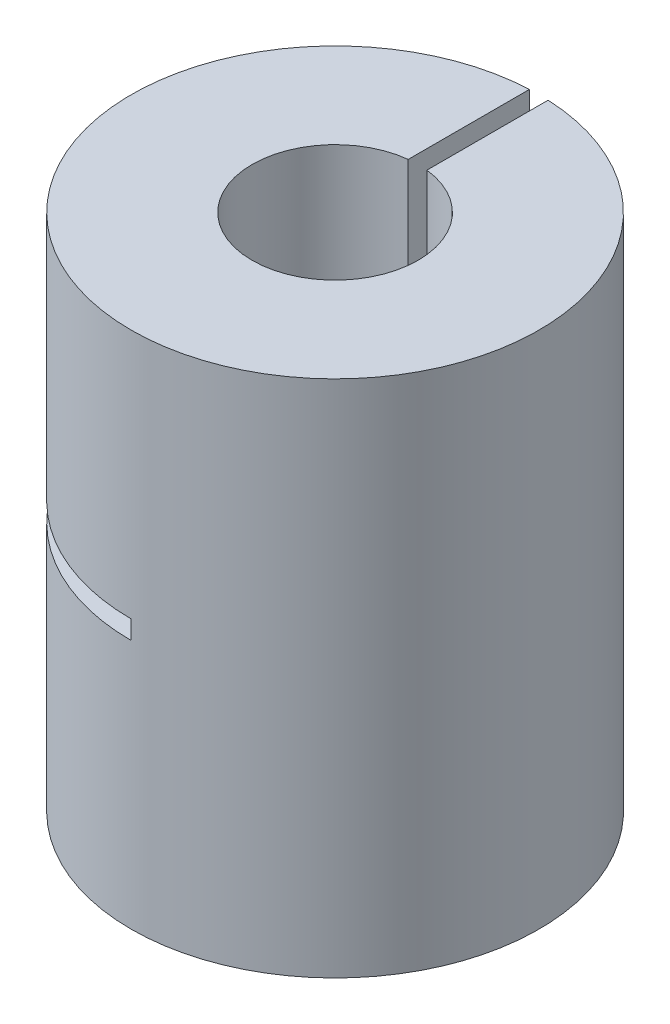
from build123d import *

# Parameters (mm, degrees)
SKETCH1_R               = 9.825
SKETCH1_R_2             = 2.505
BOSS_EXTRUDE1_DEPTH     = 25
SKETCH2_R               = 4
CUT_EXTRUDE1_DEPTH      = 13.5
CUT_EXTRUDE2_DEPTH      = 13.5
CUT_EXTRUDE2_DEPTH_BACK = 13.5
CUT_EXTRUDE3_DEPTH      = 13.5


with BuildPart() as part:
    # Sketch1 → Boss-Extrude1 (new body)
    with BuildSketch(Plane(origin=(0, 0, 0), x_dir=(1, 0, 0), z_dir=(0, 1, 0))):
        Circle(SKETCH1_R)
        Circle(SKETCH1_R_2, mode=Mode.SUBTRACT)
    extrude(amount=BOSS_EXTRUDE1_DEPTH)

    # Sketch2 → Cut-Extrude1 (cut)
    with BuildSketch(Plane(origin=(0, 25, 0), x_dir=(1, 0, 0), z_dir=(0, 1, 0))):
        Circle(SKETCH2_R)
    extrude(amount=-CUT_EXTRUDE1_DEPTH, mode=Mode.SUBTRACT)

    # Sketch3 → Cut-Extrude2 (cut, two sides: drawn at the far end of the back side and taken through both)
    with BuildSketch(Plane.XY.offset(-CUT_EXTRUDE2_DEPTH_BACK)):
        Polygon((-9.825, 12.5), (-9.825, 12.95), (0, 12.95), (0, 12.5), (0, 12.05), (-9.825, 12.05), align=None)
    extrude(amount=CUT_EXTRUDE2_DEPTH + CUT_EXTRUDE2_DEPTH_BACK, mode=Mode.SUBTRACT)

    # Sketch5 → Cut-Extrude3 (cut)
    with BuildSketch(Plane.XY):
        Polygon((0, 0), (-0.45, 0), (-0.45, 25), (0, 25), (0.45, 25), (0.45, 0), align=None)
    extrude(amount=-CUT_EXTRUDE3_DEPTH, mode=Mode.SUBTRACT)


solid = part.part
